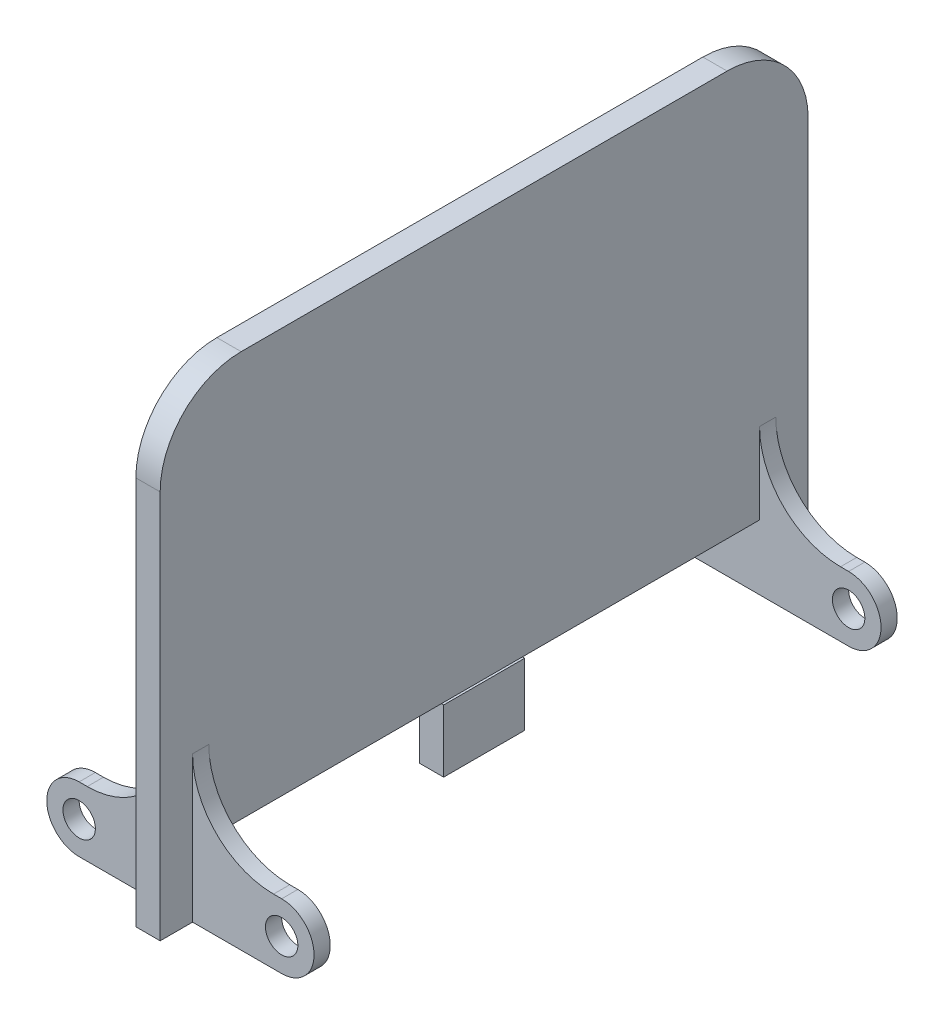
from build123d import *

# Parameters (mm, degrees)
SKETCH1_R            = 2
BOSS_EXTRUDE1_DEPTH  = 2
SKETCH2_W            = 3
SKETCH2_H            = 40
BOSS_EXTRUDE2_DEPTH  = 50
SKETCH4_W            = 3
SKETCH4_H            = 4
BOSS_EXTRUDE4_DEPTH  = 8
FILLET1_R            = 10
FILLET1_OF_MIRROR2_R = 10
FILLET2_R            = 10
SKETCH3_W            = 10
SKETCH3_H            = 7.72
BOSS_EXTRUDE3_DEPTH  = 3


with BuildPart() as part:
    # Sketch1 → Boss-Extrude1 (new body)
    with BuildSketch(Plane.XY):
        with BuildLine():
            Line((0, 4), (25, 4))
            ThreePointArc((25, 4), (29, 0), (25, -4))
            Line((25, -4), (0, -4))
            ThreePointArc((0, -4), (-4, 0), (0, 4))
        make_face()
        Circle(SKETCH1_R, mode=Mode.SUBTRACT)
        with Locations((25, 0)):
            Circle(SKETCH1_R, mode=Mode.SUBTRACT)
    boss_extrude1 = extrude(amount=BOSS_EXTRUDE1_DEPTH)

    # Sketch2 → Boss-Extrude2 (add)
    with BuildSketch(Plane(origin=(0, 4, 0), x_dir=(1, 0, 0), z_dir=(0, 1, 0))):
        with Locations((12.5, -16)):
            Rectangle(SKETCH2_W, SKETCH2_H)
    boss_extrude2 = extrude(amount=BOSS_EXTRUDE2_DEPTH)

    # Sketch4 → Boss-Extrude4 (add)
    with BuildSketch(Plane.XZ.offset(-4)):
        with Locations((12.5, -2)):
            Rectangle(SKETCH4_W, SKETCH4_H)
    boss_extrude4 = extrude(amount=BOSS_EXTRUDE4_DEPTH)

    # Fillet1
    fillet1_edges = [part.edges().sort_by_distance(p)[0] for p in [
        (14, 4, 1),
        (11, 4, 1),
    ]]
    fillet(fillet1_edges, radius=FILLET1_R)

    # Mirror1: Boss-Extrude2 across plane
    add(boss_extrude2.mirror(Plane.XY.offset(36)))

    # Mirror2: Boss-Extrude1, Boss-Extrude4 across plane
    add(boss_extrude1.mirror(Plane.XY.offset(36)))
    add(boss_extrude4.mirror(Plane.XY.offset(36)))

    # Fillet1 of Mirror2
    fillet1_of_mirror2_edges = [part.edges().sort_by_distance(p)[0] for p in [
        (14, 4, 71),
        (11, 4, 71),
    ]]
    fillet(fillet1_of_mirror2_edges, radius=FILLET1_OF_MIRROR2_R)

    # Fillet2
    fillet2_edges = [part.edges().sort_by_distance(p)[0] for p in [
        (12.5, 54, -4),
        (12.5, 54, 76),
    ]]
    fillet(fillet2_edges, radius=FILLET2_R)


with BuildPart() as body_2:
    # Sketch3 → Boss-Extrude3 (new body)
    with BuildSketch(Plane(origin=(14, 0, 0), x_dir=(0, 0, -1), z_dir=(1, 0, 0))):
        with Locations((-36, -0.14)):
            Rectangle(SKETCH3_W, SKETCH3_H)
    extrude(amount=-BOSS_EXTRUDE3_DEPTH)


solid = Compound([part.part, body_2.part])
